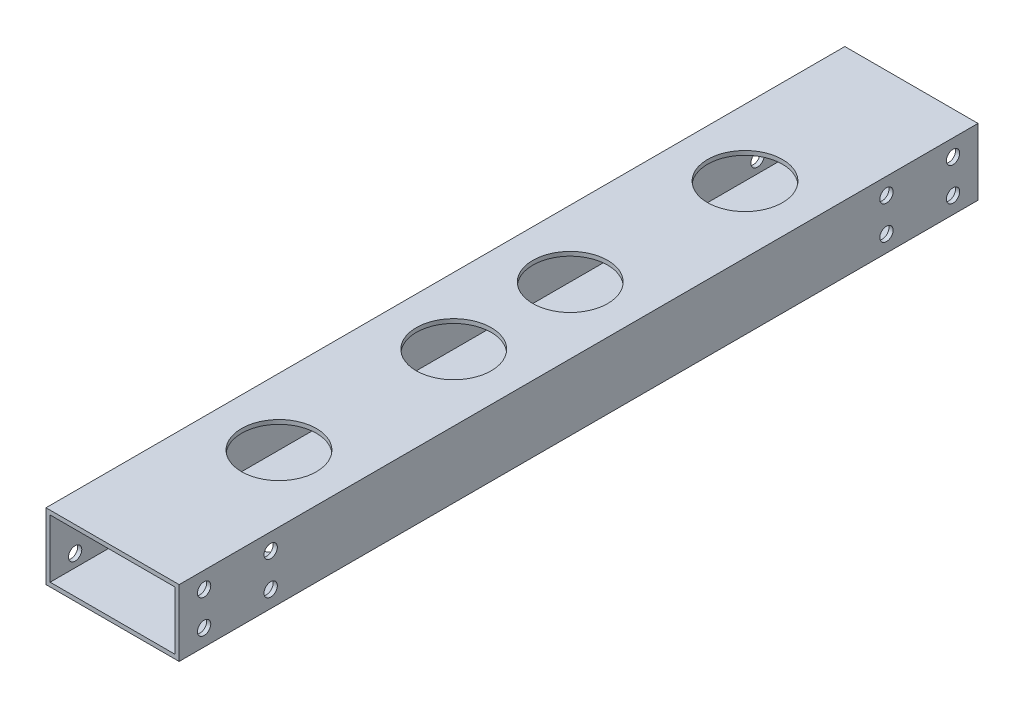
from build123d import *

# Parameters (mm, degrees)
SKETCH2_W               = 50.8
SKETCH2_H               = 25.4
SKETCH2_W_2             = 47.625
SKETCH2_H_2             = 22.225
BOSS_EXTRUDE1_DEPTH     = 152.4
SKETCH3_R               = 14.2875
CUT_EXTRUDE1_DEPTH      = 157.576115675
CUT_EXTRUDE2_DEPTH      = 162.144934764
CUT_EXTRUDE2_DEPTH_BACK = 162.144934764
SKETCH4_R               = 2.54


with BuildPart() as part:
    # Sketch2 → Boss-Extrude1 (new, symmetric)
    with BuildSketch(Plane.XY):
        Rectangle(SKETCH2_W, SKETCH2_H)
        Rectangle(SKETCH2_W_2, SKETCH2_H_2, mode=Mode.SUBTRACT)
    extrude(amount=BOSS_EXTRUDE1_DEPTH, both=True)

    # Sketch3 → Cut-Extrude1 (cut, through all)
    with BuildSketch(Plane(origin=(0, 12.7, 0), x_dir=(1, 0, 0), z_dir=(0, 1, 0))):
        with Locations(Location((0, -88.9, 0), (0, 0, 270))):
            Circle(SKETCH3_R)
        with Locations(Location((0, -22.225, 0), (0, 0, 270))):
            Circle(SKETCH3_R)
        with Locations(Location((0, 22.225, 0), (0, 0, 90))):
            Circle(SKETCH3_R)
        with Locations(Location((0, 88.9, 0), (0, 0, 90))):
            Circle(SKETCH3_R)
    extrude(amount=-CUT_EXTRUDE1_DEPTH, mode=Mode.SUBTRACT)

    # Sketch4 → Cut-Extrude2 (cut, two sides: drawn at the far end of the back side and taken through both)
    with BuildSketch(Plane.ZY.offset(25.4).offset(-CUT_EXTRUDE2_DEPTH_BACK)):
        with Locations((-142.875, 6.35)):
            Circle(SKETCH4_R)
        with Locations((-142.875, -6.35)):
            Circle(SKETCH4_R)
        with Locations((-117.475, 6.35)):
            Circle(SKETCH4_R)
        with Locations((-117.475, -6.35)):
            Circle(SKETCH4_R)
        with Locations((117.475, -6.35)):
            Circle(SKETCH4_R)
        with Locations((117.475, 6.35)):
            Circle(SKETCH4_R)
        with Locations((142.875, -6.35)):
            Circle(SKETCH4_R)
        with Locations((142.875, 6.35)):
            Circle(SKETCH4_R)
    extrude(amount=CUT_EXTRUDE2_DEPTH + CUT_EXTRUDE2_DEPTH_BACK, mode=Mode.SUBTRACT)


solid = part.part
